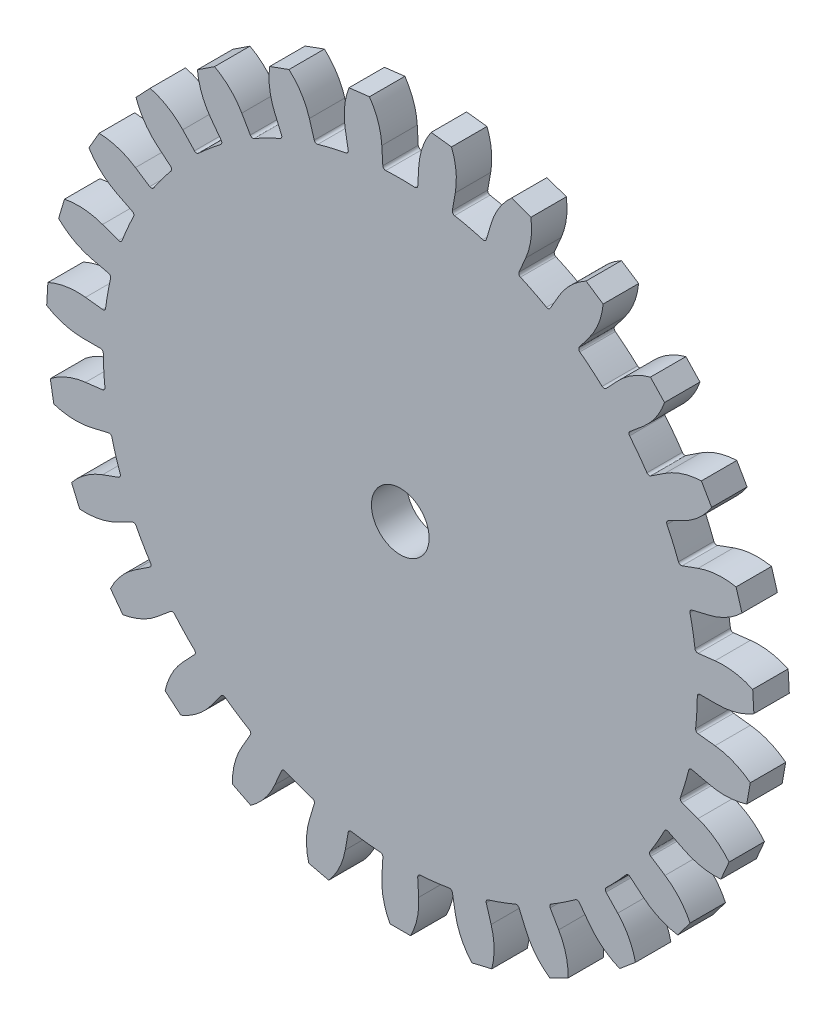
from build123d import *

# Parameters (mm, degrees)
BOSS_EXTRUDE1_DEPTH      = 3.175
FILLET1_R                = 0.254
CIRPATTERN1_COUNT        = 27
FILLET1_OF_CIRPATTERN1_R = 0.254
SKETCH2_R                = 2.582800016
CUT_EXTRUDE1_DEPTH       = 3.175


with BuildPart() as part:
    # Sketch1 → Boss-Extrude1 (new body)
    with BuildSketch(Plane.XY):
        with BuildLine():
            Line((1.654073058, 28.339413167), (1.55047369, 26.564433964))
            ThreePointArc((1.55047369, 26.564433964), (0.775566334, 26.59833862), (0, 26.609643374))
            Line((0, 26.609643374), (0, 0))
            Line((0, 0), (6.136606077, 25.892376993))
            ThreePointArc((6.136606077, 25.892376993), (5.379338178, 26.060234866), (4.617499598, 26.205950049))
            Line((4.617499598, 26.205950049), (4.92603114, 27.956976116))
            ThreePointArc((4.92603114, 27.956976116), (4.991790934, 29.679017191), (4.591682212, 31.355222079))
            Line((4.591682212, 31.355222079), (2.763099019, 31.568952802))
            ThreePointArc((2.763099019, 31.568952802), (1.987215829, 30.030201655), (1.654073058, 28.339413167))
        make_face()
    boss_extrude1 = extrude(amount=BOSS_EXTRUDE1_DEPTH)

    # Fillet1
    fillet1_edges = [part.edges().sort_by_distance(p)[0] for p in [
        (4.617499598, 26.205950049, 1.5875),
        (1.55047369, 26.564433964, 1.5875),
    ]]
    fillet(fillet1_edges, radius=FILLET1_R)

    # CirPattern1: Boss-Extrude1 ×27 about axis
    cirpattern1_axis = Axis((0, 0, 0), (0, 0, 1))
    for i in range(1, CIRPATTERN1_COUNT):
        add(boss_extrude1.rotate(cirpattern1_axis, i * 360 / CIRPATTERN1_COUNT))

    # Fillet1 of CirPattern1
    fillet1_of_cirpattern1_edges = [part.edges().sort_by_distance(p)[0] for p in [
        (-1.55047369, 26.564433964, 1.5875),
        (-4.617499598, 26.205950049, 1.5875),
        (-7.634860541, 25.490822368, 1.5875),
        (-10.536542288, 24.434696583, 1.5875),
        (-13.307650083, 23.042993941, 1.5875),
        (-15.887557256, 21.3461623, 1.5875),
        (-18.263020765, 19.352911746, 1.5875),
        (-20.3820699, 17.106850882, 1.5875),
        (-22.23382727, 14.619509069, 1.5875),
        (-23.777779879, 11.945304705, 1.5875),
        (-25.006002392, 9.097964874, 1.5875),
        (-25.891623591, 6.13978406, 1.5875),
        (-26.430097453, 3.085947038, 1.5875),
        (-26.609643174, 0.003266066, 1.5875),
        (-26.429339119, -3.092435002, 1.5875),
        (-25.893130005, -6.133428002, 1.5875),
        (-25.003768272, -9.10410307, 1.5875),
        (-23.780711495, -11.939467378, 1.5875),
        (-22.230237805, -14.624966586, 1.5875),
        (-20.386268673, -17.101846978, 1.5875),
        (-18.258269464, -19.357394367, 1.5875),
        (-15.892796831, -21.342261581, 1.5875),
        (-13.301993091, -23.046260007, 1.5875),
        (-10.542540197, -24.432109338, 1.5875),
        (-7.628602826, -25.492695805, 1.5875),
        (-4.623932493, -26.204815756, 1.5875),
        (-1.543952609, -26.564813774, 1.5875),
        (1.543952609, -26.564813774, 1.5875),
        (4.623932493, -26.204815756, 1.5875),
        (7.628602826, -25.492695805, 1.5875),
        (10.542540197, -24.432109338, 1.5875),
        (13.301993091, -23.046260007, 1.5875),
        (15.892796831, -21.342261581, 1.5875),
        (18.258269464, -19.357394367, 1.5875),
        (20.386268673, -17.101846978, 1.5875),
        (22.230237805, -14.624966586, 1.5875),
        (23.780711495, -11.939467378, 1.5875),
        (25.003768272, -9.10410307, 1.5875),
        (25.893130005, -6.133428002, 1.5875),
        (26.429339119, -3.092435002, 1.5875),
        (26.609643174, 0.003266066, 1.5875),
        (26.430097453, 3.085947038, 1.5875),
        (25.891623591, 6.13978406, 1.5875),
        (25.006002392, 9.097964874, 1.5875),
        (23.777779879, 11.945304705, 1.5875),
        (22.23382727, 14.619509069, 1.5875),
        (20.3820699, 17.106850882, 1.5875),
        (18.263020765, 19.352911746, 1.5875),
        (15.887557256, 21.3461623, 1.5875),
        (13.307650083, 23.042993941, 1.5875),
        (10.536542288, 24.434696583, 1.5875),
        (7.634860541, 25.490822368, 1.5875),
    ]]
    fillet(fillet1_of_cirpattern1_edges, radius=FILLET1_OF_CIRPATTERN1_R)

    # Sketch2 → Cut-Extrude1 (cut)
    with BuildSketch(Plane.XY.offset(3.175)):
        Circle(SKETCH2_R)
    extrude(amount=-CUT_EXTRUDE1_DEPTH, mode=Mode.SUBTRACT)


solid = part.part
